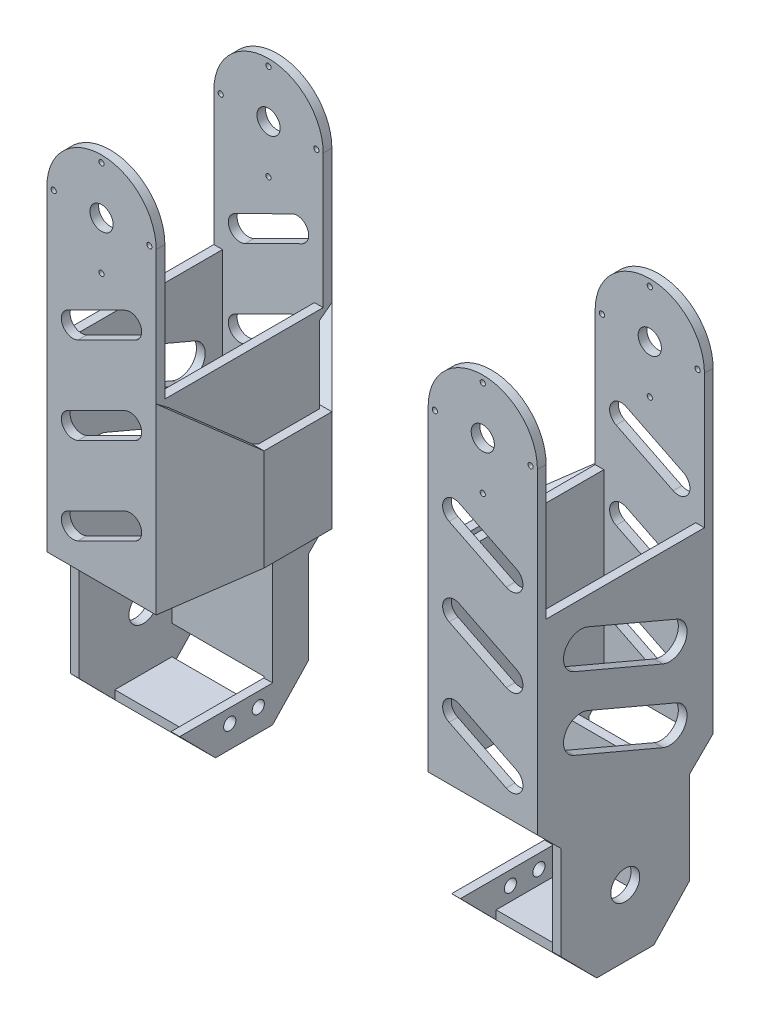
from build123d import *

# Parameters (mm, degrees)
SKETCH_1_W           = 37.7
SKETCH_1_H           = 60.6
SKETCH_1_W_2         = 31.7
SKETCH_1_H_2         = 54.6
EXTRUDE_1_DEPTH      = 60
SKETCH_2_W           = 37.7
SKETCH_2_H           = 3
EXTRUDE_2_DEPTH      = 65
CUT_EXTRUDE_1_DEPTH  = 100
SKETCH_4_W           = 37.7
SKETCH_4_H           = 60.6
EXTRUDE_3_DEPTH      = 3
SKETCH_5_W           = 3
SKETCH_5_H           = 60.6
EXTRUDE_4_DEPTH      = 60.1
SKETCH_7_W           = 5.308475652
SKETCH_7_H           = 1.585967116
CUT_EXTRUDE_2_DEPTH  = 52
SKETCH_9_R           = 2.1
SKETCH_9_W           = 19.7
SKETCH_9_H           = 40.4
CUT_EXTRUDE_4_DEPTH  = 3
SKETCH_10_W          = 31.7
SKETCH_10_H          = 54.6
CUT_EXTRUDE_5_DEPTH  = 3
SKETCH_11_R          = 5
CUT_EXTRUDE_6_DEPTH  = 3
EXTRUDE_6_DEPTH      = 63
CUT_EXTRUDE_7_DEPTH  = 18.6
SKETCH_16_R          = 0.9
CUT_EXTRUDE_8_DEPTH  = 73
SKETCH_17_R          = 4
CUT_EXTRUDE_9_DEPTH  = 93
SKETCH_21_W          = 20.45
SKETCH_21_H          = 40.4
CUT_EXTRUDE_10_DEPTH = 10
SKETCH_22_W          = 3
SKETCH_22_H          = 39.9
EXTRUDE_7_DEPTH      = 35
CUT_EXTRUDE_11_DEPTH = 39
SKETCH_24_W          = 19.7
SKETCH_24_H          = 3
EXTRUDE_8_DEPTH      = 36
CUT_EXTRUDE_12_DEPTH = 80
CUT_EXTRUDE_14_DEPTH = 20


with BuildPart() as part:
    # 草图1 → 凸台-拉伸1 (new body)
    with BuildSketch(Plane(origin=(0, 0, 0), x_dir=(1, 0, 0), z_dir=(0, 1, 0))):
        with Locations((-14.07214144, -10.711520331)):
            Rectangle(SKETCH_1_W, SKETCH_1_H)
        with Locations((-14.07214144, -10.711520331)):
            Rectangle(SKETCH_1_W_2, SKETCH_1_H_2, mode=Mode.SUBTRACT)
    extrude(amount=EXTRUDE_1_DEPTH)

    # 草图2 → 凸台-拉伸2 (add)
    with BuildSketch(Plane(origin=(0, 60, 0), x_dir=(1, 0, 0), z_dir=(0, 1, 0))):
        with Locations((-14.07214144, 18.088479669)):
            Rectangle(SKETCH_2_W, SKETCH_2_H)
        with Locations((-14.07214144, -39.511520331)):
            Rectangle(SKETCH_2_W, SKETCH_2_H)
    extrude(amount=EXTRUDE_2_DEPTH)

    # 草图3 → 切除-拉伸1 (cut)
    with BuildSketch(Plane.XY.offset(41.011520331)):
        with BuildLine():
            Line((4.77785856, 125), (-14.07214144, 125))
            ThreePointArc((-14.07214144, 125), (-0.743178614, 119.478962825), (4.77785856, 106.15))
            Line((4.77785856, 106.15), (4.77785856, 125))
        make_face()
        with BuildLine():
            Line((-32.92214144, 125), (-32.92214144, 106.15))
            ThreePointArc((-32.92214144, 106.15), (-27.401104265, 119.478962825), (-14.07214144, 125))
            Line((-14.07214144, 125), (-32.92214144, 125))
        make_face()
    extrude(amount=-CUT_EXTRUDE_1_DEPTH, mode=Mode.SUBTRACT)

    # 草图4 → 凸台-拉伸3 (add)
    with BuildSketch(Plane.XZ):
        with Locations((-14.07214144, 10.711520331)):
            Rectangle(SKETCH_4_W, SKETCH_4_H)
    extrude(amount=EXTRUDE_3_DEPTH)

    # 草图5 → 凸台-拉伸4 (add)
    with BuildSketch(Plane.XZ.offset(3)):
        with Locations((-31.42214144, 10.711520331)):
            Rectangle(SKETCH_5_W, SKETCH_5_H)
        with Locations((3.27785856, 10.711520331)):
            Rectangle(SKETCH_5_W, SKETCH_5_H)
    extrude(amount=EXTRUDE_4_DEPTH)

    # 草图7 → 切除-拉伸2 (cut)
    with BuildSketch(Plane(origin=(4.77785856, 0, 0), x_dir=(0, 0, -1), z_dir=(1, 0, 0))):
        with Locations((-55.382521172, -90.859075485)):
            Rectangle(SKETCH_7_W, SKETCH_7_H)
        Polygon((-32.894548617, -33.05), (-32.894548617, -11.05), (-41.011520331, -3), (-41.011520331, -63.1), (-32.894548617, -63.1), align=None)
        Polygon((19.588479669, -63.1), (19.588479669, -3), (11.471507955, -11.05), (11.471507955, -33.05), (11.471507955, -63.1), align=None)
    extrude(amount=-CUT_EXTRUDE_2_DEPTH, mode=Mode.SUBTRACT)

    # 草图9 → 切除-拉伸4 (cut)
    with BuildSketch(Plane(origin=(4.77785856, 0, 0), x_dir=(0, 0, -1), z_dir=(1, 0, 0))):
        with Locations((-15.636520331, -48.16)):
            Circle(SKETCH_9_R)
        with Locations((-5.786520331, -48.16)):
            Circle(SKETCH_9_R)
        with Locations((-5.786520331, 1.76)):
            Circle(SKETCH_9_R)
        with Locations((-15.636520331, 1.76)):
            Circle(SKETCH_9_R)
        with Locations((-10.711520331, -23.2)):
            Rectangle(SKETCH_9_W, SKETCH_9_H)
    extrude(amount=-CUT_EXTRUDE_4_DEPTH, mode=Mode.SUBTRACT)

    # 草图10 → 切除-拉伸5 (cut)
    with BuildSketch(Plane.XZ.offset(3)):
        with Locations((-14.07214144, 10.711520331)):
            Rectangle(SKETCH_10_W, SKETCH_10_H)
    extrude(amount=-CUT_EXTRUDE_5_DEPTH, mode=Mode.SUBTRACT)

    # 草图11 → 切除-拉伸6 (cut)
    with BuildSketch(Plane.ZY.offset(32.92214144)):
        with Locations((10.711520331, -33.05)):
            Circle(SKETCH_11_R)
    extrude(amount=-CUT_EXTRUDE_6_DEPTH, mode=Mode.SUBTRACT)

    # 草图14 → 凸台-拉伸6 (add)
    with BuildSketch(Plane(origin=(0, 60, 0), x_dir=(1, 0, 0), z_dir=(0, 1, 0))):
        Polygon((23.37785856, 0.988479669), (4.77785856, 19.588479669), (4.77785856, 16.588479669), (4.77785856, 15.345838982), (20.37785856, -0.254161018), (20.37785856, -21.168879644), (4.77785856, -36.768879644), (4.77785856, -38.011520331), (4.77785856, -41.011520331), (23.37785856, -22.411520331), align=None)
    extrude(amount=-EXTRUDE_6_DEPTH)

    # 草图15 → 切除-拉伸7 (cut)
    with BuildSketch(Plane(origin=(23.37785856, 0, 0), x_dir=(0, 0, -1), z_dir=(1, 0, 0))):
        Polygon((-22.411520331, 11), (0.988479669, 11), (19.588479669, -3), (-41.011520331, -3), align=None)
        Polygon((-41.011520331, 60), (19.588479669, 60), (0.988479669, 46), (-22.411520331, 46), align=None)
    extrude(amount=-CUT_EXTRUDE_7_DEPTH, mode=Mode.SUBTRACT)

    # 草图16 → 切除-拉伸8 (cut)
    with BuildSketch(Plane.XY.offset(41.011520331)):
        with Locations((-14.07214144, 122.65)):
            Circle(SKETCH_16_R)
        with Locations((2.42785856, 106.15)):
            Circle(SKETCH_16_R)
        with Locations((-30.57214144, 106.15)):
            Circle(SKETCH_16_R)
        with Locations((-14.07214144, 89.65)):
            Circle(SKETCH_16_R)
    extrude(amount=-CUT_EXTRUDE_8_DEPTH, mode=Mode.SUBTRACT)

    # 草图17 → 切除-拉伸9 (cut)
    with BuildSketch(Plane(origin=(0, 0, -19.588479669), x_dir=(-1, 0, 0), z_dir=(0, 0, -1))):
        with Locations((14.07214144, 106.15)):
            Circle(SKETCH_17_R)
    extrude(amount=-CUT_EXTRUDE_9_DEPTH, mode=Mode.SUBTRACT)


with BuildPart() as body_2:
    # 镜向2: mirrored copy
    add(part.part.mirror(Plane(origin=(51.67785856, 0, 0), x_dir=(0, 0, 1), z_dir=(1, 0, 0))))


with BuildPart() as part_1:
    add(part.part)

    # 草图21 → 切除-拉伸10 (cut)
    with BuildSketch(Plane(origin=(4.77785856, 0, 0), x_dir=(0, 0, -1), z_dir=(1, 0, 0))):
        with Locations((-30.786520331, -23.2)):
            Rectangle(SKETCH_21_W, SKETCH_21_H)
    extrude(amount=-CUT_EXTRUDE_10_DEPTH, mode=Mode.SUBTRACT)

    # 草图22 → 凸台-拉伸7 (add)
    with BuildSketch(Plane(origin=(4.77785856, 0, 0), x_dir=(0, 0, -1), z_dir=(1, 0, 0))):
        with Locations((0.638479669, -22.95)):
            Rectangle(SKETCH_22_W, SKETCH_22_H)
    extrude(amount=-EXTRUDE_7_DEPTH)

    # 草图23 → 切除-拉伸11 (cut)
    with BuildSketch(Plane(origin=(4.77785856, 0, 0), x_dir=(0, 0, -1), z_dir=(1, 0, 0))):
        Polygon((-20.561520331, -55.92), (-32.894548617, -43.4), (-32.894548617, -63.1), (11.471507955, -63.1), (11.471507955, -42.9), (-0.861520331, -55.92), align=None)
    extrude(amount=-CUT_EXTRUDE_11_DEPTH, mode=Mode.SUBTRACT)

    # 草图24 → 凸台-拉伸8 (add)
    with BuildSketch(Plane(origin=(4.77785856, 0, 0), x_dir=(0, 0, -1), z_dir=(1, 0, 0))):
        with Locations((-10.711520331, -54.42)):
            Rectangle(SKETCH_24_W, SKETCH_24_H)
    extrude(amount=-EXTRUDE_8_DEPTH)

    # 草图25 → 切除-拉伸12 (cut)
    with BuildSketch(Plane.XY.offset(41.011520331)):
        with BuildLine():
            Line((-2.441529603, 75.464864369), (-22.141529603, 65.671499268))
            ThreePointArc((-22.141529603, 65.671499268), (-27.503959621, 67.472705613), (-25.702753276, 72.835135631))
            Line((-25.702753276, 72.835135631), (-6.002753276, 82.628500732))
            ThreePointArc((-6.002753276, 82.628500732), (-0.640323258, 80.827294387), (-2.441529603, 75.464864369))
        make_face()
        with BuildLine():
            Line((-2.441529603, 45.464864369), (-22.141529603, 35.671499268))
            ThreePointArc((-22.141529603, 35.671499268), (-27.503959621, 37.472705613), (-25.702753276, 42.835135631))
            Line((-25.702753276, 42.835135631), (-6.002753276, 52.628500732))
            ThreePointArc((-6.002753276, 52.628500732), (-0.640323258, 50.827294387), (-2.441529603, 45.464864369))
        make_face()
        with BuildLine():
            Line((-2.441529603, 15.464864369), (-22.141529603, 5.671499268))
            ThreePointArc((-22.141529603, 5.671499268), (-27.503959621, 7.472705613), (-25.702753276, 12.835135631))
            Line((-25.702753276, 12.835135631), (-6.002753276, 22.628500732))
            ThreePointArc((-6.002753276, 22.628500732), (-0.640323258, 20.827294387), (-2.441529603, 15.464864369))
        make_face()
    extrude(amount=-CUT_EXTRUDE_12_DEPTH, mode=Mode.SUBTRACT)

    # 草图28 → 切除-拉伸14 (cut)
    with BuildSketch(Plane.ZY.offset(32.92214144)):
        with BuildLine():
            Line((28.357599862, 39.477689719), (-2.242400138, 26.477689719))
            ThreePointArc((-2.242400138, 26.477689719), (-10.11078995, 29.653920469), (-6.9345592, 37.522310281))
            Line((-6.9345592, 37.522310281), (23.6654408, 50.522310281))
            ThreePointArc((23.6654408, 50.522310281), (31.533830611, 47.346079531), (28.357599862, 39.477689719))
        make_face()
        with BuildLine():
            Line((28.357599862, 14.477689719), (-2.242400138, 1.477689719))
            ThreePointArc((-2.242400138, 1.477689719), (-10.11078995, 4.653920469), (-6.9345592, 12.522310281))
            Line((-6.9345592, 12.522310281), (23.6654408, 25.522310281))
            ThreePointArc((23.6654408, 25.522310281), (31.533830611, 22.346079531), (28.357599862, 14.477689719))
        make_face()
    extrude(amount=-CUT_EXTRUDE_14_DEPTH, mode=Mode.SUBTRACT)


with BuildPart() as body_2_2:
    # 镜向6: mirrored copy
    add(part_1.part.mirror(Plane(origin=(51.67785856, 0, 0), x_dir=(0, 0, 1), z_dir=(1, 0, 0))))


solid = Compound([part_1.part, body_2_2.part])
